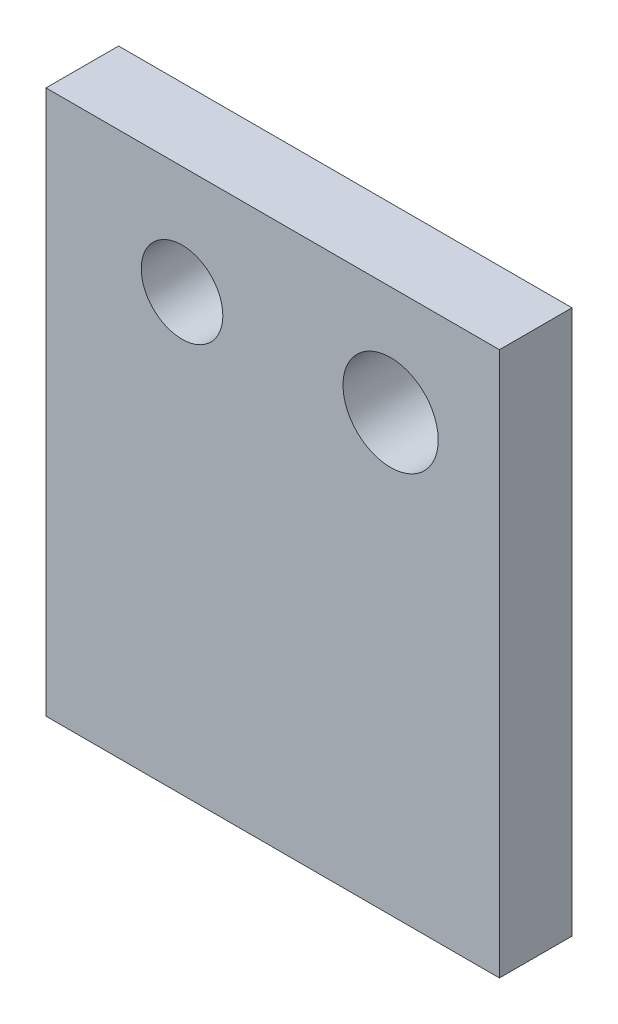
from build123d import *

# Parameters (mm, degrees)
SKETCH1_W           = 50
SKETCH1_H           = 60
SKETCH1_R           = 4.5
BOSS_EXTRUDE1_DEPTH = 8
SKETCH2_R           = 5.25
CUT_EXTRUDE2_DEPTH  = 40.862262856


with BuildPart() as part:
    # Sketch1 → Boss-Extrude1 (new body)
    with BuildSketch(Plane.XY):
        Rectangle(SKETCH1_W, SKETCH1_H)
        with Locations((-10, 18)):
            Circle(SKETCH1_R, mode=Mode.SUBTRACT)
    extrude(amount=BOSS_EXTRUDE1_DEPTH)

    # Sketch2 → Cut-Extrude2 (cut, through all)
    with BuildSketch(Plane.XY):
        with Locations((13, 18)):
            Circle(SKETCH2_R)
    extrude(amount=CUT_EXTRUDE2_DEPTH, mode=Mode.SUBTRACT)


solid = part.part
